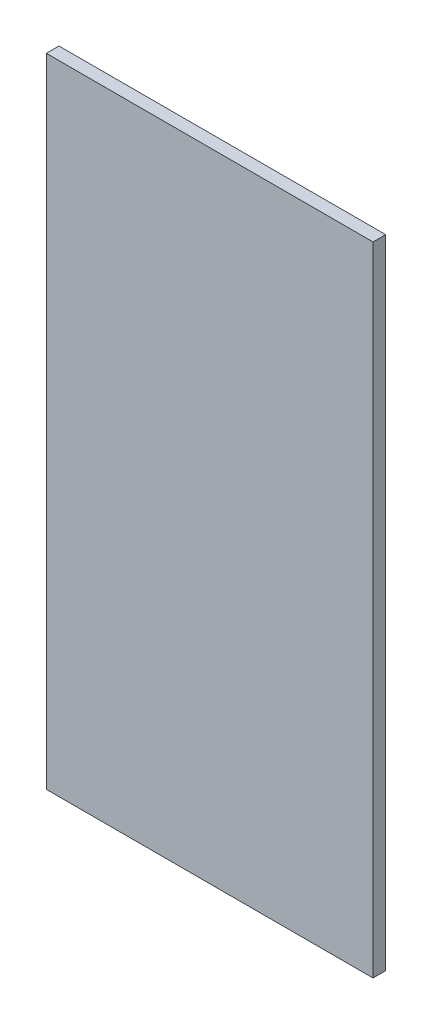
from build123d import *

# Parameters (mm, degrees)
SKETCH1_W           = 82
SKETCH1_H           = 160
BOSS_EXTRUDE1_DEPTH = 3.175


with BuildPart() as part:
    # Sketch1 → Boss-Extrude1 (new body)
    with BuildSketch(Plane.XY):
        with Locations((41, 80)):
            Rectangle(SKETCH1_W, SKETCH1_H)
    extrude(amount=BOSS_EXTRUDE1_DEPTH)


solid = part.part
